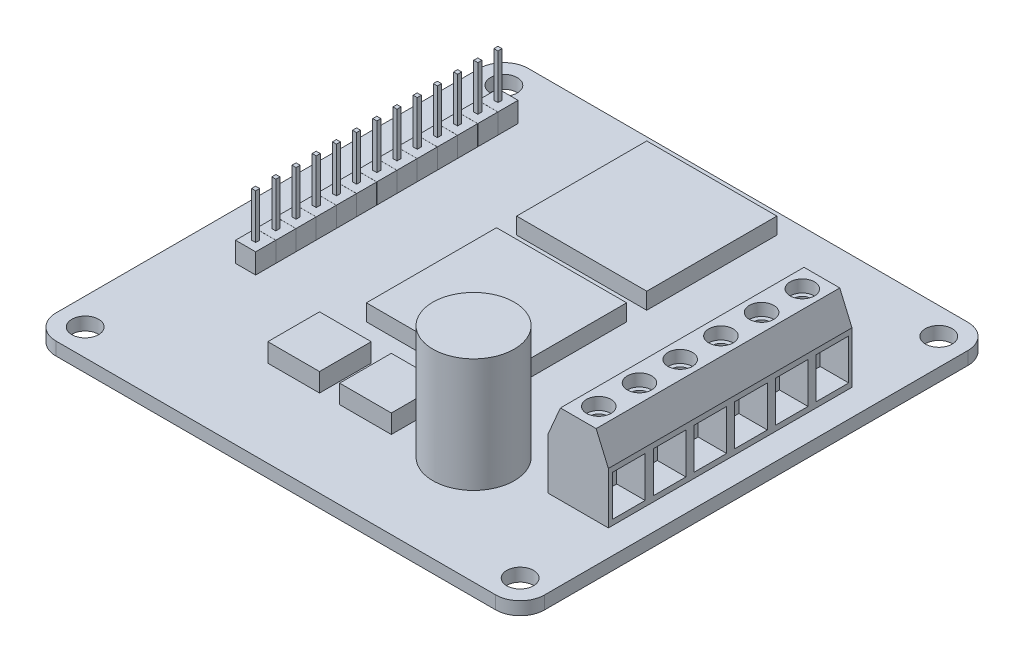
from build123d import *

# Parameters (mm, degrees)
BOSS_EXTRUDE1_DEPTH = 1.6
SKETCH2_R           = 1.645
CUT_EXTRUDE1_DEPTH  = 1.6
SKETCH3_W           = 15.98
SKETCH3_H           = 15.98
BOSS_EXTRUDE2_DEPTH = 2.03
SKETCH4_W           = 6.35
SKETCH4_H           = 6.35
BOSS_EXTRUDE3_DEPTH = 2.29
SKETCH5_R           = 5
BOSS_EXTRUDE4_DEPTH = 14
SKETCH6_W           = 7.39
SKETCH6_H           = 29.92
BOSS_EXTRUDE5_DEPTH = 9.82
CUT_EXTRUDE2_DEPTH  = 29.92
SKETCH8_R           = 1.5
CUT_EXTRUDE3_DEPTH  = 1.5
SKETCH9_W           = 2.47
SKETCH9_H           = 2.47
BOSS_EXTRUDE6_DEPTH = 2.47
SKETCH10_W          = 0.5
SKETCH10_H          = 0.5
BOSS_EXTRUDE7_DEPTH = 5.5
SKETCH11_W          = 4
SKETCH11_H          = 5
CUT_EXTRUDE4_DEPTH  = 3.5
SKETCH12_R          = 1
CUT_EXTRUDE5_DEPTH  = 9.8


with BuildPart() as part:
    # Sketch1 → Boss-Extrude1 (new body)
    with BuildSketch(Plane(origin=(0, 0, 0), x_dir=(1, 0, 0), z_dir=(0, 1, 0))):
        with BuildLine():
            Line((-27, -29), (27, -29))
            ThreePointArc((27, -29), (29.121320344, -28.121320344), (30, -26))
            Line((30, -26), (30, 26))
            ThreePointArc((30, 26), (29.121320344, 28.121320344), (27, 29))
            Line((27, 29), (-27, 29))
            ThreePointArc((-27, 29), (-29.121320344, 28.121320344), (-30, 26))
            Line((-30, 26), (-30, -26))
            ThreePointArc((-30, -26), (-29.121320344, -28.121320344), (-27, -29))
        make_face()
    extrude(amount=BOSS_EXTRUDE1_DEPTH)

    # Sketch2 → Cut-Extrude1 (cut)
    with BuildSketch(Plane(origin=(0, 1.6, 0), x_dir=(1, 0, 0), z_dir=(0, 1, 0))):
        with Locations(Location((-26.71, 25.71, 0), (0, 0, 270))):
            Circle(SKETCH2_R)
        with Locations(Location((26.71, 25.71, 0), (0, 0, 270))):
            Circle(SKETCH2_R)
        with Locations(Location((-26.71, -25.71, 0), (0, 0, 270))):
            Circle(SKETCH2_R)
        with Locations(Location((26.71, -25.71, 0), (0, 0, 270))):
            Circle(SKETCH2_R)
    extrude(amount=-CUT_EXTRUDE1_DEPTH, mode=Mode.SUBTRACT)

    # Sketch3 → Boss-Extrude2 (add)
    with BuildSketch(Plane(origin=(0, 1.6, 0), x_dir=(1, 0, 0), z_dir=(0, 1, 0))):
        with Locations((-1.990594769, 18.54)):
            Rectangle(SKETCH3_W, SKETCH3_H)
        with Locations((-1.990594769, 0.09)):
            Rectangle(SKETCH3_W, SKETCH3_H)
    extrude(amount=BOSS_EXTRUDE2_DEPTH)

    # Sketch4 → Boss-Extrude3 (add)
    with BuildSketch(Plane(origin=(0, 1.6, 0), x_dir=(1, 0, 0), z_dir=(0, 1, 0))):
        with Locations((0.354405231, -15.175)):
            Rectangle(SKETCH4_W, SKETCH4_H)
        with Locations((-8.465594769, -15.175)):
            Rectangle(SKETCH4_W, SKETCH4_H)
    extrude(amount=BOSS_EXTRUDE3_DEPTH)

    # Sketch5 → Boss-Extrude4 (add)
    with BuildSketch(Plane(origin=(0, 1.6, 0), x_dir=(1, 0, 0), z_dir=(0, 1, 0))):
        with Locations(Location((10.999405231, -15.718441706, 0), (0, 0, 90))):
            Circle(SKETCH5_R)
    extrude(amount=BOSS_EXTRUDE4_DEPTH)

    # Sketch6 → Boss-Extrude5 (add)
    with BuildSketch(Plane(origin=(0, 1.6, 0), x_dir=(1, 0, 0), z_dir=(0, 1, 0))):
        with Locations((23.102343367, 0)):
            Rectangle(SKETCH6_W, SKETCH6_H)
    extrude(amount=BOSS_EXTRUDE5_DEPTH)

    # Sketch7 → Cut-Extrude2 (cut)
    with BuildSketch(Plane.XY.offset(14.96)):
        Polygon((19.407343367, 11.42), (20.907343367, 11.42), (19.407343367, 7.92858195), align=None)
        Polygon((26.797343367, 11.42), (25.297343367, 11.42), (26.797343367, 7.92858195), align=None)
    extrude(amount=-CUT_EXTRUDE2_DEPTH, mode=Mode.SUBTRACT)

    # Sketch8 → Cut-Extrude3 (cut)
    with BuildSketch(Plane(origin=(0, 11.42, 0), x_dir=(1, 0, 0), z_dir=(0, 1, 0))):
        with Locations(Location((23.097343367, 12.56, 0), (0, 0, 270))):
            Circle(SKETCH8_R)
        with Locations(Location((23.097343367, 7.56, 0), (0, 0, 270))):
            Circle(SKETCH8_R)
        with Locations(Location((23.097343367, 2.56, 0), (0, 0, 270))):
            Circle(SKETCH8_R)
        with Locations(Location((23.097343367, -2.44, 0), (0, 0, 270))):
            Circle(SKETCH8_R)
        with Locations(Location((23.097343367, -7.44, 0), (0, 0, 270))):
            Circle(SKETCH8_R)
        with Locations(Location((23.097343367, -12.44, 0), (0, 0, 270))):
            Circle(SKETCH8_R)
    extrude(amount=-CUT_EXTRUDE3_DEPTH, mode=Mode.SUBTRACT)

    # Sketch9 → Boss-Extrude6 (add)
    with BuildSketch(Plane(origin=(0, 1.6, 0), x_dir=(1, 0, 0), z_dir=(0, 1, 0))):
        with Locations((-23, -8.484036475)):
            Rectangle(SKETCH9_W, SKETCH9_H)
        with Locations((-23, -6.004036475)):
            Rectangle(SKETCH9_W, SKETCH9_H)
        with Locations((-23, -3.524036475)):
            Rectangle(SKETCH9_W, SKETCH9_H)
        with Locations((-23, -1.044036475)):
            Rectangle(SKETCH9_W, SKETCH9_H)
        with Locations((-23, 1.435963525)):
            Rectangle(SKETCH9_W, SKETCH9_H)
        with Locations((-23, 3.915963525)):
            Rectangle(SKETCH9_W, SKETCH9_H)
        with Locations((-23, 6.395963525)):
            Rectangle(SKETCH9_W, SKETCH9_H)
        with Locations((-23, 8.875963525)):
            Rectangle(SKETCH9_W, SKETCH9_H)
        with Locations((-23, 11.355963525)):
            Rectangle(SKETCH9_W, SKETCH9_H)
        with Locations((-23, 13.835963525)):
            Rectangle(SKETCH9_W, SKETCH9_H)
        with Locations((-23, 16.315963525)):
            Rectangle(SKETCH9_W, SKETCH9_H)
        with Locations((-23, 18.795963525)):
            Rectangle(SKETCH9_W, SKETCH9_H)
        with Locations((-23, 21.275963525)):
            Rectangle(SKETCH9_W, SKETCH9_H)
    extrude(amount=BOSS_EXTRUDE6_DEPTH)

    # Sketch10 → Boss-Extrude7 (add)
    with BuildSketch(Plane(origin=(0, 4.07, 0), x_dir=(1, 0, 0), z_dir=(0, 1, 0))):
        with Locations((-23, -8.484036475)):
            Rectangle(SKETCH10_W, SKETCH10_H)
        with Locations((-23, -6.004036475)):
            Rectangle(SKETCH10_W, SKETCH10_H)
        with Locations((-23, -3.524036475)):
            Rectangle(SKETCH10_W, SKETCH10_H)
        with Locations((-23, -1.044036475)):
            Rectangle(SKETCH10_W, SKETCH10_H)
        with Locations((-23, 1.435963525)):
            Rectangle(SKETCH10_W, SKETCH10_H)
        with Locations((-23, 3.915963525)):
            Rectangle(SKETCH10_W, SKETCH10_H)
        with Locations((-23, 6.395963525)):
            Rectangle(SKETCH10_W, SKETCH10_H)
        with Locations((-23, 8.875963525)):
            Rectangle(SKETCH10_W, SKETCH10_H)
        with Locations((-23, 11.355963525)):
            Rectangle(SKETCH10_W, SKETCH10_H)
        with Locations((-23, 13.835963525)):
            Rectangle(SKETCH10_W, SKETCH10_H)
        with Locations((-23, 16.315963525)):
            Rectangle(SKETCH10_W, SKETCH10_H)
        with Locations((-23, 18.795963525)):
            Rectangle(SKETCH10_W, SKETCH10_H)
        with Locations((-23, 21.275963525)):
            Rectangle(SKETCH10_W, SKETCH10_H)
    extrude(amount=BOSS_EXTRUDE7_DEPTH)

    # Sketch11 → Cut-Extrude4 (cut)
    with BuildSketch(Plane(origin=(26.797343367, 0, 0), x_dir=(0, 0, -1), z_dir=(1, 0, 0))):
        with Locations((7.56, 4.764290975)):
            Rectangle(SKETCH11_W, SKETCH11_H)
        with Locations((12.56, 4.764290975)):
            Rectangle(SKETCH11_W, SKETCH11_H)
        with Locations((2.56, 4.764290975)):
            Rectangle(SKETCH11_W, SKETCH11_H)
        with Locations((-2.44, 4.764290975)):
            Rectangle(SKETCH11_W, SKETCH11_H)
        with Locations((-7.44, 4.764290975)):
            Rectangle(SKETCH11_W, SKETCH11_H)
        with Locations((-12.44, 4.764290975)):
            Rectangle(SKETCH11_W, SKETCH11_H)
    extrude(amount=-CUT_EXTRUDE4_DEPTH, mode=Mode.SUBTRACT)

    # Sketch12 → Cut-Extrude5 (cut)
    with BuildSketch(Plane(origin=(0, 9.92, 0), x_dir=(1, 0, 0), z_dir=(0, 1, 0))):
        with Locations(Location((23.097343367, -12.44, 0), (0, 0, 270))):
            Circle(SKETCH12_R)
        with Locations(Location((23.097343367, -7.44, 0), (0, 0, 270))):
            Circle(SKETCH12_R)
        with Locations(Location((23.097343367, -2.44, 0), (0, 0, 270))):
            Circle(SKETCH12_R)
        with Locations(Location((23.097343367, 2.56, 0), (0, 0, 270))):
            Circle(SKETCH12_R)
        with Locations(Location((23.097343367, 7.56, 0), (0, 0, 270))):
            Circle(SKETCH12_R)
        with Locations(Location((23.097343367, 12.56, 0), (0, 0, 270))):
            Circle(SKETCH12_R)
    extrude(amount=-CUT_EXTRUDE5_DEPTH, mode=Mode.SUBTRACT)


solid = part.part
